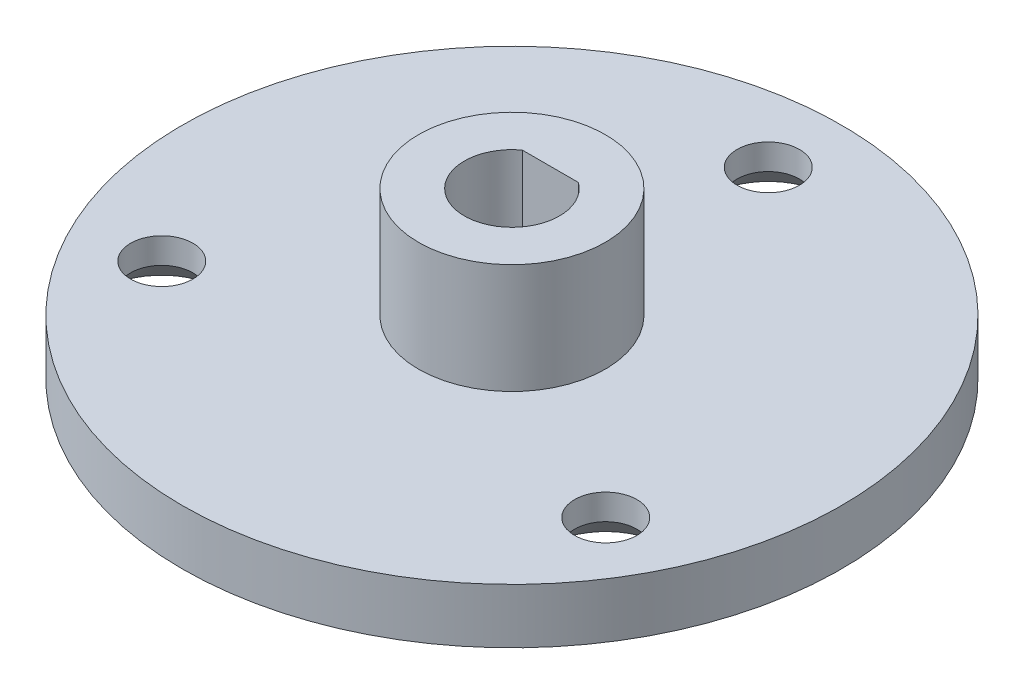
from build123d import *

# Parameters (mm, degrees)
SKETCH_1_R               = 18
SKETCH_1_R_2             = 1.6
EXTRUDE_1_DEPTH          = 3
HOLE_WIZARD_2_AT_2_COUNT = 2
HOLE_WIZARD_2_AT_2_PITCH = 24.248711306
HOLE_WIZARD_2_AT_3_COUNT = 2
HOLE_WIZARD_2_AT_3_PITCH = 24.248711306
SKETCH_9_R               = 5.1
EXTRUDE_2_DEPTH          = 6


with BuildPart() as part:
    # 草图1 → 凸台-拉伸1 (new body)
    with BuildSketch(Plane(origin=(0, 0, 0), x_dir=(1, 0, 0), z_dir=(0, 1, 0))):
        with Locations(Location((0, 0, 0), (0, 0, 270))):
            Circle(SKETCH_1_R)
        with BuildLine():
            Line((-1.532970972, 2.1), (1.532970972, 2.1))
            ThreePointArc((1.532970972, 2.1), (0, -2.6), (-1.532970972, 2.1))
        make_face(mode=Mode.SUBTRACT)
        with Locations(Location((-12.124355653, -7, 0), (0, 0, 270))):
            Circle(SKETCH_1_R_2, mode=Mode.SUBTRACT)
        with Locations(Location((12.124355653, -7, 0), (0, 0, 270))):
            Circle(SKETCH_1_R_2, mode=Mode.SUBTRACT)
        with Locations(Location((0, 14, 0), (0, 0, 270))):
            Circle(SKETCH_1_R_2, mode=Mode.SUBTRACT)
    extrude(amount=EXTRUDE_1_DEPTH)

    # 草图8 → 打孔尺寸(%根据十字)槽沉头木螺钉的类型2 (revolve, cut)
    with BuildSketch(Plane(origin=(12.124355653, 0, 7), x_dir=(0, 0, -1), z_dir=(1, 0, 0))):
        Polygon((0, 0), (0, 3), (1.7, 3), (1.7, 1.6), (3.3, 0), align=None)
    hole_wizard_2 = revolve(axis=Axis((12.124355653, -6.35, 7), (0, 1, 0)), mode=Mode.SUBTRACT)

    # 打孔尺寸(%根据十字)槽沉头木螺钉的类型2 at 2: 打孔尺寸(%根据十字)槽沉头木螺钉的类型2 ×2
    with Locations(*[(-i * HOLE_WIZARD_2_AT_2_PITCH, 0, 0) for i in range(1, HOLE_WIZARD_2_AT_2_COUNT)]):
        add(hole_wizard_2, mode=Mode.SUBTRACT)

    # 打孔尺寸(%根据十字)槽沉头木螺钉的类型2 at 3: 打孔尺寸(%根据十字)槽沉头木螺钉的类型2 ×2
    with Locations(*[Vector(-0.5000000000000048, 0, -0.8660254037844359) * (i * HOLE_WIZARD_2_AT_3_PITCH) for i in range(1, HOLE_WIZARD_2_AT_3_COUNT)]):
        add(hole_wizard_2, mode=Mode.SUBTRACT)

    # 草图9 → 凸台-拉伸2 (add)
    with BuildSketch(Plane(origin=(0, 3, 0), x_dir=(1, 0, 0), z_dir=(0, 1, 0))):
        with Locations(Location((0, 0, 0), (0, 0, 270))):
            Circle(SKETCH_9_R)
        with BuildLine():
            Line((-1.532970972, 2.1), (1.532970972, 2.1))
            ThreePointArc((1.532970972, 2.1), (0, -2.6), (-1.532970972, 2.1))
        make_face(mode=Mode.SUBTRACT)
    extrude(amount=EXTRUDE_2_DEPTH)


solid = part.part
